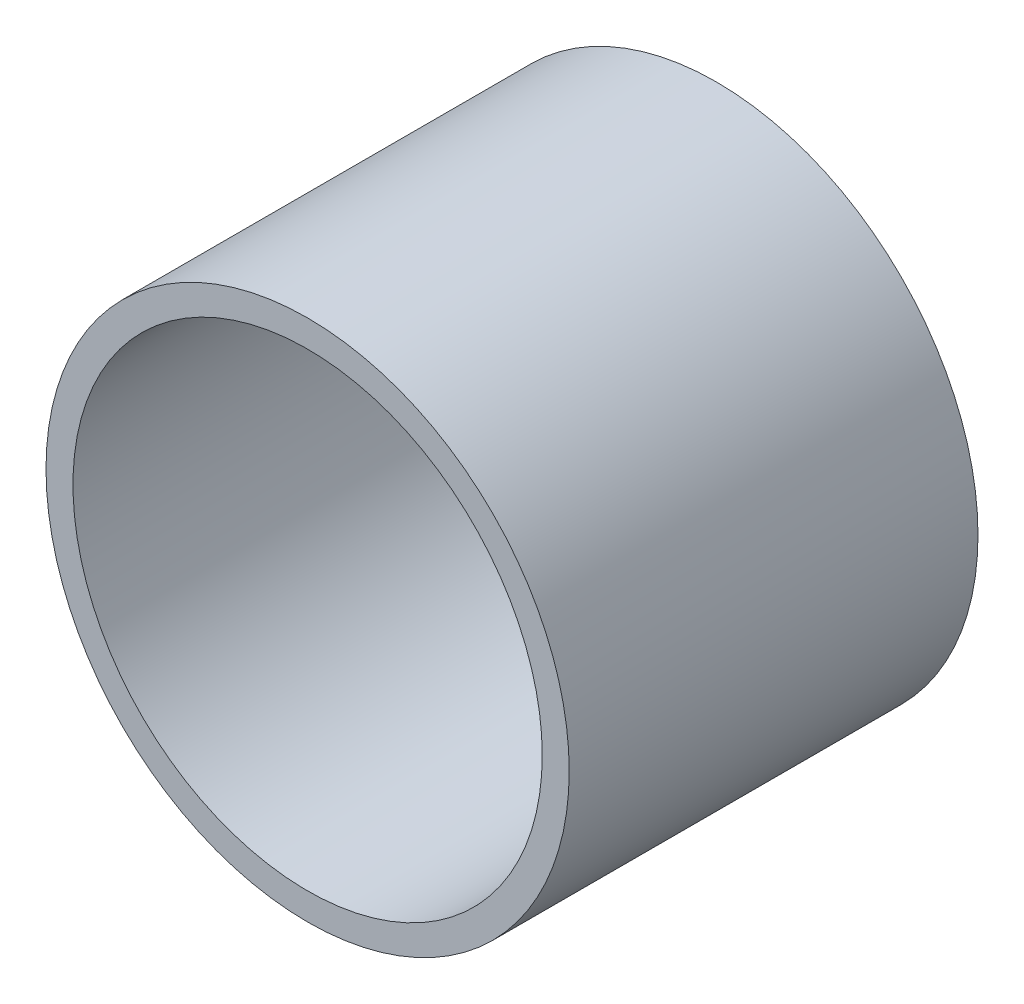
from build123d import *

# Parameters (mm, degrees)
SKETCH1_R           = 32
SKETCH1_R_2         = 28.7
BOSS_EXTRUDE1_DEPTH = 50


with BuildPart() as part:
    # Sketch1 → Boss-Extrude1 (new body)
    with BuildSketch(Plane.XY):
        Circle(SKETCH1_R)
        Circle(SKETCH1_R_2, mode=Mode.SUBTRACT)
    extrude(amount=BOSS_EXTRUDE1_DEPTH)


solid = part.part
